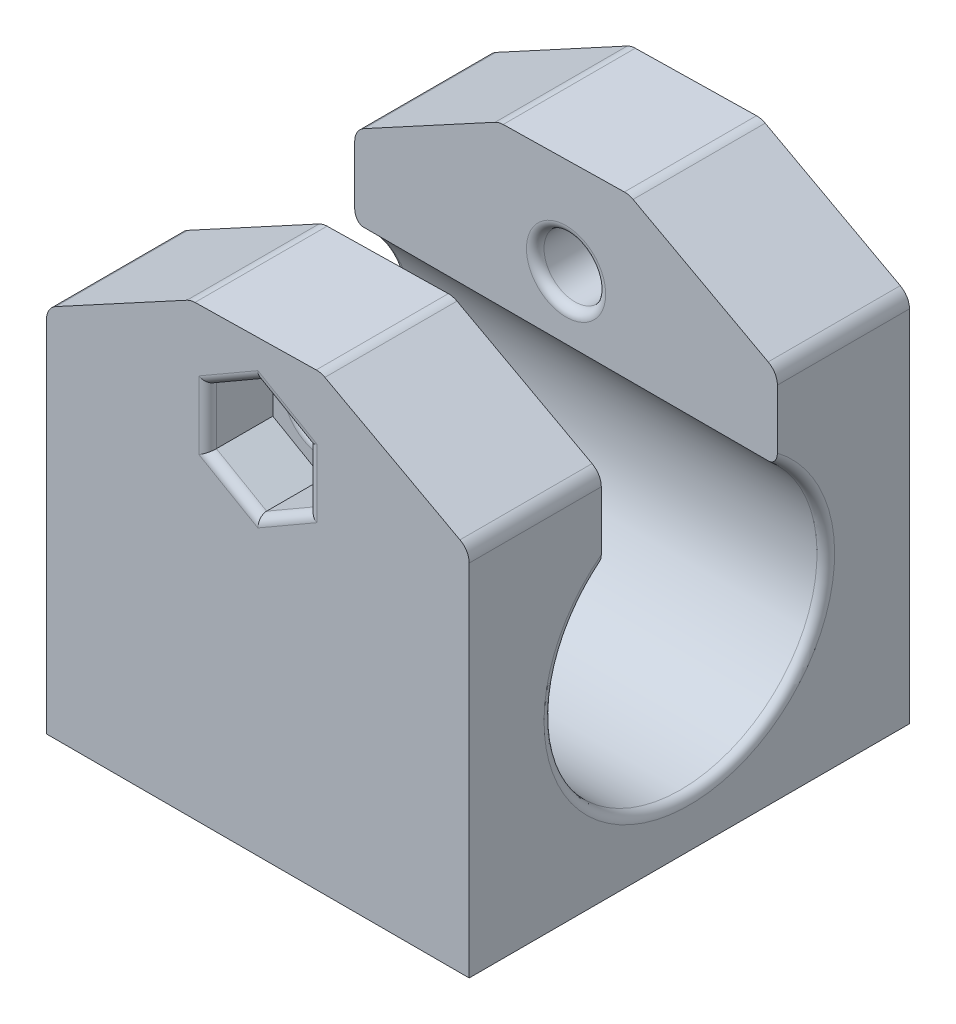
from build123d import *

# Parameters (mm, degrees)
SKETCH1_W           = 24
SKETCH1_H           = 25
BOSS_EXTRUDE1_DEPTH = 21
SKETCH2_R           = 7.75
CUT_EXTRUDE1_DEPTH  = 36.284699234
SKETCH3_W           = 10
SKETCH3_H           = 4.578640359
CUT_EXTRUDE2_DEPTH  = 36.284699234
FILLET4_R           = 0.5
SKETCH4_W           = 24
SKETCH4_H           = 7.5
BOSS_EXTRUDE2_DEPTH = 6.5
SKETCH6_W           = 24
SKETCH6_H           = 7.5
BOSS_EXTRUDE3_DEPTH = 6.5
CUT_EXTRUDE5_DEPTH  = 40.575371233
CUT_EXTRUDE6_DEPTH  = 40.575371233
CUT_EXTRUDE7_DEPTH  = 40.575371233
SKETCH15_R          = 1.75
CUT_EXTRUDE8_DEPTH  = 39.255097839
FILLET5_R           = 0.5
SKETCH16_R          = 3
CUT_EXTRUDE9_DEPTH  = 3.7
FILLET6_R           = 0.5
CUT_EXTRUDE10_DEPTH = 3.7
FILLET7_R           = 0.5
FILLET8_R           = 0.5
FILLET9_R           = 0.5
FILLET10_R          = 0.5
FILLET14_R          = 1


with BuildPart() as part:
    # Sketch1 → Boss-Extrude1 (new body)
    with BuildSketch(Plane(origin=(0, 0, 0), x_dir=(1, 0, 0), z_dir=(0, 1, 0))):
        with Locations((-1.6, -2.6)):
            Rectangle(SKETCH1_W, SKETCH1_H)
    extrude(amount=BOSS_EXTRUDE1_DEPTH)

    # Sketch2 → Cut-Extrude1 (cut, through all)
    with BuildSketch(Plane(origin=(10.4, 0, 0), x_dir=(0, 0, -1), z_dir=(1, 0, 0))):
        with Locations((-2.6, 10.5)):
            Circle(SKETCH2_R)
    extrude(amount=-CUT_EXTRUDE1_DEPTH, mode=Mode.SUBTRACT)

    # Sketch3 → Cut-Extrude2 (cut, through all)
    with BuildSketch(Plane(origin=(10.4, 0, 0), x_dir=(0, 0, -1), z_dir=(1, 0, 0))):
        with Locations((-2.6, 18.710679821)):
            Rectangle(SKETCH3_W, SKETCH3_H)
    extrude(amount=-CUT_EXTRUDE2_DEPTH, mode=Mode.SUBTRACT)

    # Fillet4
    fillet4_edges = [part.edges().sort_by_distance(p)[0] for p in [
        (-13.6, 2.75, 2.6),
        (10.4, 2.75, 2.6),
    ]]
    fillet(fillet4_edges, radius=FILLET4_R)

    # Sketch4 → Boss-Extrude2 (add)
    with BuildSketch(Plane(origin=(0, 21, 0), x_dir=(1, 0, 0), z_dir=(0, 1, 0))):
        with Locations((-1.6, 6.15)):
            Rectangle(SKETCH4_W, SKETCH4_H)
    extrude(amount=BOSS_EXTRUDE2_DEPTH)

    # Sketch6 → Boss-Extrude3 (add)
    with BuildSketch(Plane(origin=(0, 21, 0), x_dir=(1, 0, 0), z_dir=(0, 1, 0))):
        with Locations((-1.6, -11.35)):
            Rectangle(SKETCH6_W, SKETCH6_H)
    extrude(amount=BOSS_EXTRUDE3_DEPTH)

    # Sketch5 → Cut-Extrude5 (cut, through all)
    with BuildSketch(Plane(origin=(0, 0, -9.9), x_dir=(-1, 0, 0), z_dir=(0, 0, -1))):
        Polygon((-10.4, 21), (1.6, 27.5), (-10.4, 27.5), align=None)
    extrude(amount=-CUT_EXTRUDE5_DEPTH, mode=Mode.SUBTRACT)

    # Sketch13 → Cut-Extrude6 (cut, through all)
    with BuildSketch(Plane(origin=(0, 0, -9.9), x_dir=(-1, 0, 0), z_dir=(0, 0, -1))):
        Polygon((1.6, 27.5), (13.6, 20.994425467), (13.6, 27.5), align=None)
    extrude(amount=-CUT_EXTRUDE6_DEPTH, mode=Mode.SUBTRACT)

    # Sketch14 → Cut-Extrude7 (cut, through all)
    with BuildSketch(Plane(origin=(0, 0, -9.9), x_dir=(-1, 0, 0), z_dir=(0, 0, -1))):
        Polygon((-1.975077984, 25.563499425), (1.6, 27.5), (5.414104211, 25.432255065), (1.6, 25.5), align=None)
    extrude(amount=-CUT_EXTRUDE7_DEPTH, mode=Mode.SUBTRACT)

    # Sketch15 → Cut-Extrude8 (cut, through all)
    with BuildSketch(Plane(origin=(0, 0, -9.9), x_dir=(-1, 0, 0), z_dir=(0, 0, -1))):
        with Locations((1.6, 19.999132505)):
            Circle(SKETCH15_R)
    extrude(amount=-CUT_EXTRUDE8_DEPTH, mode=Mode.SUBTRACT)

    # Fillet5
    fillet5_edges = [part.edges().sort_by_distance(p)[0] for p in [
        (0.15, 19.999132505, -9.9),
    ]]
    fillet(fillet5_edges, radius=FILLET5_R)

    # Sketch16 → Cut-Extrude9 (cut)
    with BuildSketch(Plane(origin=(0, 0, -9.9), x_dir=(-1, 0, 0), z_dir=(0, 0, -1))):
        with Locations((1.6, 19.999175888)):
            Circle(SKETCH16_R)
    extrude(amount=-CUT_EXTRUDE9_DEPTH, mode=Mode.SUBTRACT)

    # Fillet6
    fillet6_edges = [part.edges().sort_by_distance(p)[0] for p in [
        (1.4, 19.999175888, -9.9),
        (0.15, 19.999132505, -6.2),
    ]]
    fillet(fillet6_edges, radius=FILLET6_R)

    # Sketch17 → Cut-Extrude10 (cut)
    with BuildSketch(Plane.XY.offset(15.1)):
        Polygon((-4.45, 21.644580772), (-4.45, 18.353684238), (-1.6, 16.708235971), (1.25, 18.353684238), (1.25, 21.644580772), (-1.6, 23.290029039), align=None)
    extrude(amount=-CUT_EXTRUDE10_DEPTH, mode=Mode.SUBTRACT)

    # Fillet7
    fillet7_edges = [part.edges().sort_by_distance(p)[0] for p in [
        (-3.025, 22.467304906, 15.1),
        (-4.45, 19.999132505, 15.1),
        (-3.025, 17.530960104, 15.1),
        (-0.175, 17.530960104, 15.1),
        (1.25, 19.999132505, 15.1),
        (-0.175, 22.467304906, 15.1),
    ]]
    fillet(fillet7_edges, radius=FILLET7_R)

    # Fillet8
    fillet8_edges = [part.edges().sort_by_distance(p)[0] for p in [
        (0.15, 19.999132505, 11.4),
    ]]
    fillet(fillet8_edges, radius=FILLET8_R)

    # Fillet9
    fillet9_edges = [part.edges().sort_by_distance(p)[0] for p in [
        (0.15, 19.999132505, -2.4),
    ]]
    fillet(fillet9_edges, radius=FILLET9_R)

    # Fillet10
    fillet10_edges = [part.edges().sort_by_distance(p)[0] for p in [
        (0.15, 19.999132505, 7.6),
    ]]
    fillet(fillet10_edges, radius=FILLET10_R)

    # Fillet14
    fillet14_edges = [part.edges().sort_by_distance(p)[0] for p in [
        (-13.6, 20.994425467, 11.35),
        (-13.6, 20.994425467, -6.15),
        (1.975077984, 25.563499425, 11.35),
        (1.975077984, 25.563499425, -6.15),
        (-5.414104211, 25.432255065, 11.35),
        (-5.414104211, 25.432255065, -6.15),
        (10.4, 21, 11.35),
        (10.4, 21, -6.15),
    ]]
    fillet(fillet14_edges, radius=FILLET14_R)


solid = part.part
